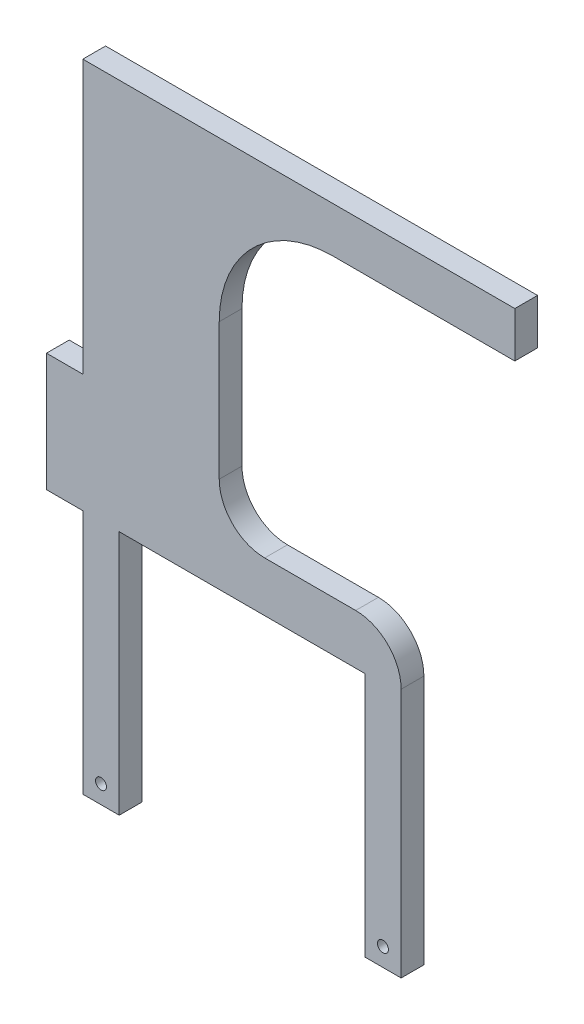
from build123d import *

# Parameters (mm, degrees)
BOSS_EXTRU_1_DEPTH      = 5
CONG_2_R                = 25
ESQUISSE5_W             = 40
ESQUISSE5_H             = 15
ENL_V_MAT_EXTRU_1_DEPTH = 5
CONG_3_R                = 10
ESQUISSE2_R             = 1
ENL_V_MAT_EXTRU_5_DEPTH = 10
D_GAGEMENT_M21_D        = 2.4
ESQUISSE9_W             = 25
ESQUISSE9_H             = 10
ENL_V_MAT_EXTRU_6_DEPTH = 5


with BuildPart() as part:
    # Esquisse1 → Boss.-Extru.1 (new body)
    with BuildSketch(Plane.XY):
        Polygon((0, 0), (0, 54), (-8, 54), (-8, 80), (0, 80), (0, 140), (120, 140), (120, 130), (30, 130), (30, 80), (70, 80), (70, 0), (62, 0), (62, 54), (8, 54), (8, 0), align=None)
    extrude(amount=BOSS_EXTRU_1_DEPTH)

    # Congé2
    cong_2_edges = [part.edges().sort_by_distance(p)[0] for p in [
        (30, 130, 2.5),
    ]]
    fillet(cong_2_edges, radius=CONG_2_R)

    # Esquisse5 → Enlèv. mat.-Extru.1 (cut)
    with BuildSketch(Plane.XY.offset(5)):
        with Locations((50, 72.5)):
            Rectangle(ESQUISSE5_W, ESQUISSE5_H)
    extrude(amount=-ENL_V_MAT_EXTRU_1_DEPTH, mode=Mode.SUBTRACT)

    # Congé3
    cong_3_edges = [part.edges().sort_by_distance(p)[0] for p in [
        (70, 65, 2.5),
        (30, 65, 2.5),
    ]]
    fillet(cong_3_edges, radius=CONG_3_R)

    # Esquisse2 → Enlèv. mat.-Extru.5 (cut)
    with BuildSketch(Plane.XY.offset(5)):
        with Locations((4, 4)):
            Circle(ESQUISSE2_R)
        with Locations((66, 4)):
            Circle(ESQUISSE2_R)
    extrude(amount=-ENL_V_MAT_EXTRU_5_DEPTH, mode=Mode.SUBTRACT)

    # Dégagement M21 (through all)
    with Locations(Plane.XY.offset(5)):
        with Locations((4, 4), (66, 4)):
            Hole(D_GAGEMENT_M21_D / 2)

    # Esquisse9 → Enlèv. mat.-Extru.6 (cut)
    with BuildSketch(Plane.XY.offset(5)):
        with Locations((107.5, 135)):
            Rectangle(ESQUISSE9_W, ESQUISSE9_H)
    extrude(amount=-ENL_V_MAT_EXTRU_6_DEPTH, mode=Mode.SUBTRACT)


solid = part.part
